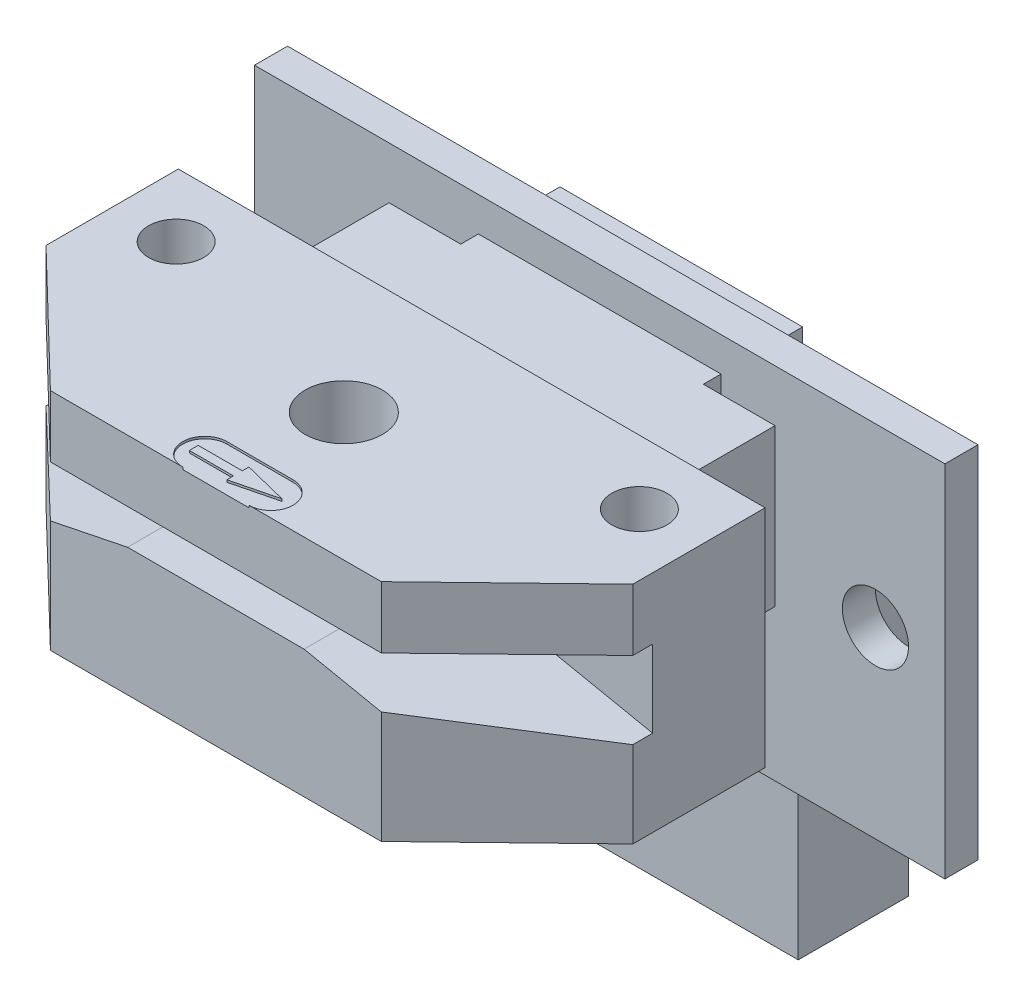
from build123d import *

# Parameters (mm, degrees)
BOSS_EXTRUDE1_DEPTH = 10.2
SKETCH2_R           = 1.25
SKETCH2_R_2         = 1.75
CUT_EXTRUDE1_DEPTH  = 10.2
CUT_EXTRUDE2_DEPTH  = 6.5
SKETCH4_W           = 9
SKETCH4_H           = 1.6
CUT_EXTRUDE3_DEPTH  = 2.5
CUT_EXTRUDE4_DEPTH  = 0.1
BOSS_EXTRUDE2_DEPTH = 0.1
SKETCH7_W           = 17.5
SKETCH7_H           = 7.1
BOSS_EXTRUDE3_DEPTH = 5
SKETCH8_W           = 11
SKETCH8_H           = 1
BOSS_EXTRUDE4_DEPTH = 0.8
SKETCH10_W          = 31.3
SKETCH10_H          = 16.3
BOSS_EXTRUDE5_DEPTH = 1.5
SKETCH11_R          = 1.5
CUT_EXTRUDE5_DEPTH  = 1.5
SKETCH13_W          = 11
SKETCH13_H          = 1
BOSS_EXTRUDE6_DEPTH = 2.2
SKETCH14_W          = 15
SKETCH14_H          = 14
BOSS_EXTRUDE7_DEPTH = 5


with BuildPart() as part:
    # Sketch1 → Boss-Extrude1 (new body)
    with BuildSketch(Plane(origin=(0, 0, 0), x_dir=(1, 0, 0), z_dir=(0, 1, 0))):
        Polygon((-13.3, 0), (13.3, 0), (13.3, -6), (7.5, -11.6), (-7.5, -11.6), (-13.3, -6), align=None)
    extrude(amount=BOSS_EXTRUDE1_DEPTH)

    # Sketch2 → Cut-Extrude1 (cut)
    with BuildSketch(Plane(origin=(0, 10.2, 0), x_dir=(1, 0, 0), z_dir=(0, 1, 0))):
        with Locations(Location((-10.5, -2.9, 0), (0, 0, 270))):
            Circle(SKETCH2_R)
        with Locations(Location((10.5, -2.9, 0), (0, 0, 90))):
            Circle(SKETCH2_R)
        with Locations(Location((0, -5.8, 0), (0, 0, 270))):
            Circle(SKETCH2_R_2)
    extrude(amount=-CUT_EXTRUDE1_DEPTH, mode=Mode.SUBTRACT)

    # Sketch3 → Cut-Extrude2 (cut)
    with BuildSketch(Plane.XY.offset(11.6)):
        Polygon((-4, 5.8), (4, 5.8), (13.3, 3.9), (13.3, 7.4), (-13.3, 7.4), (-13.3, 3.9), align=None)
    extrude(amount=-CUT_EXTRUDE2_DEPTH, mode=Mode.SUBTRACT)

    # Sketch4 → Cut-Extrude3 (cut)
    with BuildSketch(Plane.XY.offset(5.1)):
        with Locations((0, 6.6)):
            Rectangle(SKETCH4_W, SKETCH4_H)
    extrude(amount=-CUT_EXTRUDE3_DEPTH, mode=Mode.SUBTRACT)

    # Sketch5 → Cut-Extrude4 (cut)
    with BuildSketch(Plane(origin=(0, 10.2, 0), x_dir=(1, 0, 0), z_dir=(0, 1, 0))):
        with BuildLine():
            Line((-1.5, -9.6), (1.5, -9.6))
            ThreePointArc((1.5, -9.6), (2.5, -10.6), (1.5, -11.6))
            Line((1.5, -11.6), (-1.5, -11.6))
            ThreePointArc((-1.5, -11.6), (-2.5, -10.6), (-1.5, -9.6))
        make_face()
    extrude(amount=-CUT_EXTRUDE4_DEPTH, mode=Mode.SUBTRACT)

    # Sketch6 → Boss-Extrude2 (add)
    with BuildSketch(Plane(origin=(0, 10.1, 0), x_dir=(1, 0, 0), z_dir=(0, 1, 0))):
        Polygon((0, -10.4), (0, -10.1), (2, -10.6), (0, -11.1), (0, -10.8), (-2, -10.8), (-2, -10.4), align=None)
    extrude(amount=BOSS_EXTRUDE2_DEPTH)

    # Sketch7 → Boss-Extrude3 (add)
    with BuildSketch(Plane(origin=(0, 0, 0), x_dir=(-1, 0, 0), z_dir=(0, 0, -1))):
        with Locations((0, 5.1)):
            Rectangle(SKETCH7_W, SKETCH7_H)
    extrude(amount=BOSS_EXTRUDE3_DEPTH)

    # Sketch8 → Boss-Extrude4 (add)
    with BuildSketch(Plane(origin=(0, 0, -5), x_dir=(-1, 0, 0), z_dir=(0, 0, -1))):
        with Locations((0, 8.15)):
            Rectangle(SKETCH8_W, SKETCH8_H)
    extrude(amount=BOSS_EXTRUDE4_DEPTH)

    # Sketch10 → Boss-Extrude5 (add)
    with BuildSketch(Plane(origin=(0, 0, -5.8), x_dir=(-1, 0, 0), z_dir=(0, 0, -1))):
        with Locations((0, 2.05)):
            Rectangle(SKETCH10_W, SKETCH10_H)
    extrude(amount=BOSS_EXTRUDE5_DEPTH)

    # Sketch11 → Cut-Extrude5 (cut)
    with BuildSketch(Plane(origin=(0, 0, -7.3), x_dir=(-1, 0, 0), z_dir=(0, 0, -1))):
        with Locations((-12.5, 2.2)):
            Circle(SKETCH11_R)
        with Locations(Location((12.5, 2.2, 0), (0, 0, 180))):
            Circle(SKETCH11_R)
    extrude(amount=-CUT_EXTRUDE5_DEPTH, mode=Mode.SUBTRACT)

    # Sketch13 → Boss-Extrude6 (add)
    with BuildSketch(Plane(origin=(0, 0, -7.3), x_dir=(-1, 0, 0), z_dir=(0, 0, -1))):
        with Locations((0, 8.15)):
            Rectangle(SKETCH13_W, SKETCH13_H)
    extrude(amount=BOSS_EXTRUDE6_DEPTH)


with BuildPart() as body_2:
    # Sketch14 → Boss-Extrude7 (new body)
    with BuildSketch(Plane(origin=(0, 0, -7.3), x_dir=(-1, 0, 0), z_dir=(0, 0, -1))):
        with Locations((0, -7.1)):
            Rectangle(SKETCH14_W, SKETCH14_H)
    extrude(amount=BOSS_EXTRUDE7_DEPTH)


solid = Compound([part.part, body_2.part])
